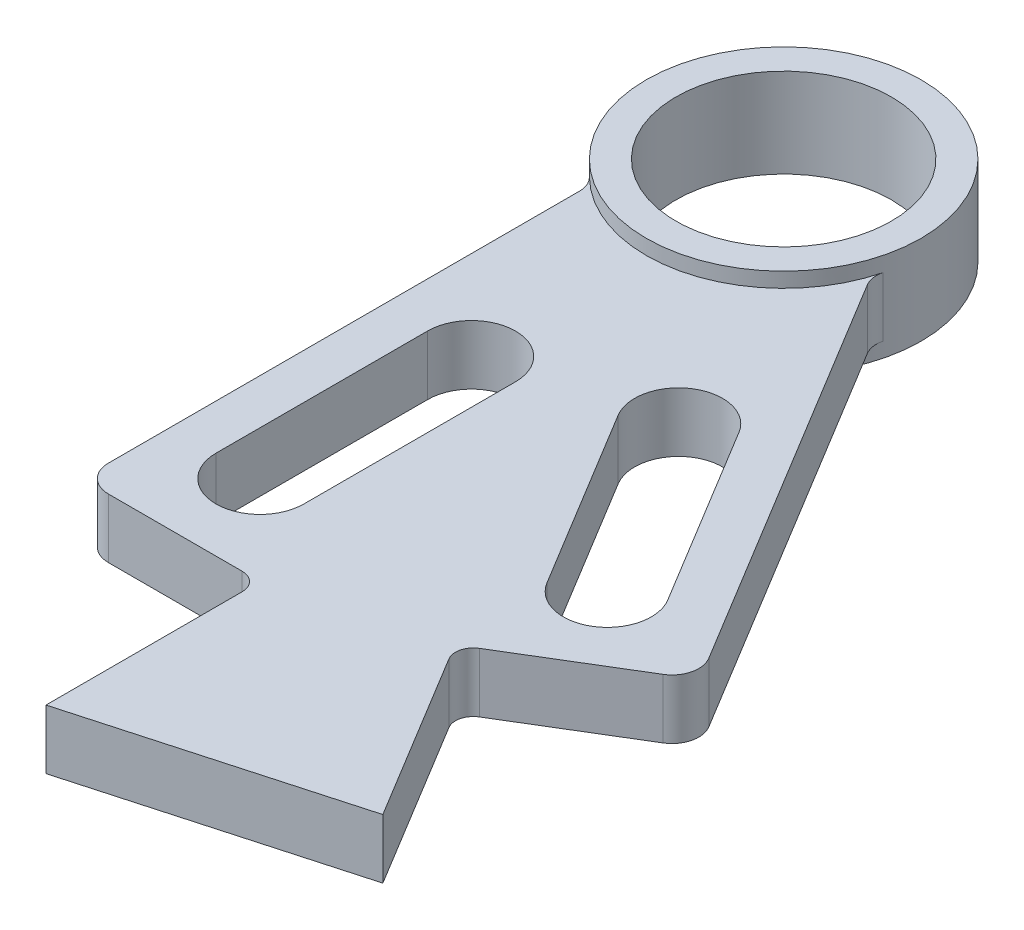
from build123d import *

# Parameters (mm, degrees)
SKETCH1_R             = 14.6812
SKETCH1_R_2           = 11.5062
BEARING_EXTRUDE_DEPTH = 4.7625
BOSS_EXTRUDE2_DEPTH   = 3.175
FILLET1_R             = 2.54
FILLET2_R             = 1.905
FILLET3_R             = 2.8575


with BuildPart() as part:
    # Sketch1 → Bearing extrude (new, symmetric)
    with BuildSketch(Plane(origin=(0, 0, 0), x_dir=(1, 0, 0), z_dir=(0, 1, 0))):
        with Locations(Location((0, 0, 0), (0, 0, 90))):
            Circle(SKETCH1_R)
        with Locations(Location((0, 0, 0), (0, 0, 90))):
            Circle(SKETCH1_R_2, mode=Mode.SUBTRACT)
    extrude(amount=BEARING_EXTRUDE_DEPTH, both=True)

    # Sketch1<5> → Boss-Extrude2 (add, symmetric)
    with BuildSketch(Plane(origin=(0, 0, 0), x_dir=(1, 0, 0), z_dir=(0, 1, 0))):
        with BuildLine():
            Line((-9.525, -11.171929486), (-9.525, -65.4812))
            Line((-9.525, -65.4812), (9.525, -65.4812))
            Line((9.525, -65.4812), (9.525, -88.3412))
            Line((9.525, -88.3412), (37.653512805, -80.480471022))
            Line((37.653512805, -80.480471022), (25.802250815, -60.932397223))
            Line((25.802250815, -60.932397223), (33.947281565, -55.994371394))
            Line((33.947281565, -55.994371394), (42.092312315, -51.056345565))
            Line((42.092312315, -51.056345565), (13.936870788, -4.615329467))
            ThreePointArc((13.936870788, -4.615329467), (3.951379748, -14.13945655), (-9.525, -11.171929486))
        make_face()
        with BuildLine():
            ThreePointArc((4.699, -55.9562), (0, -60.6552), (-4.699, -55.9562))
            Line((-4.699, -55.9562), (-4.699, -33.3502))
            ThreePointArc((-4.699, -33.3502), (0, -28.6512), (4.699, -33.3502))
            Line((4.699, -33.3502), (4.699, -55.9562))
        make_face(mode=Mode.SUBTRACT)
        with BuildLine():
            ThreePointArc((33.027470906, -45.413247902), (33.573140629, -48.968070141), (31.445348478, -51.867555814))
            ThreePointArc((31.445348478, -51.867555814), (27.890526239, -52.413225537), (24.991040566, -50.285433386))
            Line((24.991040566, -50.285433386), (13.271459266, -30.954560407))
            ThreePointArc((13.271459266, -30.954560407), (14.853581693, -24.500252495), (21.307889605, -26.082374923))
            Line((21.307889605, -26.082374923), (33.027470906, -45.413247902))
        make_face(mode=Mode.SUBTRACT)
    extrude(amount=BOSS_EXTRUDE2_DEPTH, both=True)

    # Fillet1
    fillet1_edges = [part.edges().sort_by_distance(p)[0] for p in [
        (13.936870788, 0, 4.615329467),
        (-9.525, 0, 11.171929486),
    ]]
    fillet(fillet1_edges, radius=FILLET1_R)

    # Fillet2
    fillet2_edges = [part.edges().sort_by_distance(p)[0] for p in [
        (25.802250815, 0, 60.932397223),
        (9.525, 0, 65.4812),
    ]]
    fillet(fillet2_edges, radius=FILLET2_R)

    # Fillet3
    fillet3_edges = [part.edges().sort_by_distance(p)[0] for p in [
        (42.092312315, 0, 51.056345565),
        (-9.525, 0, 65.4812),
    ]]
    fillet(fillet3_edges, radius=FILLET3_R)


solid = part.part
